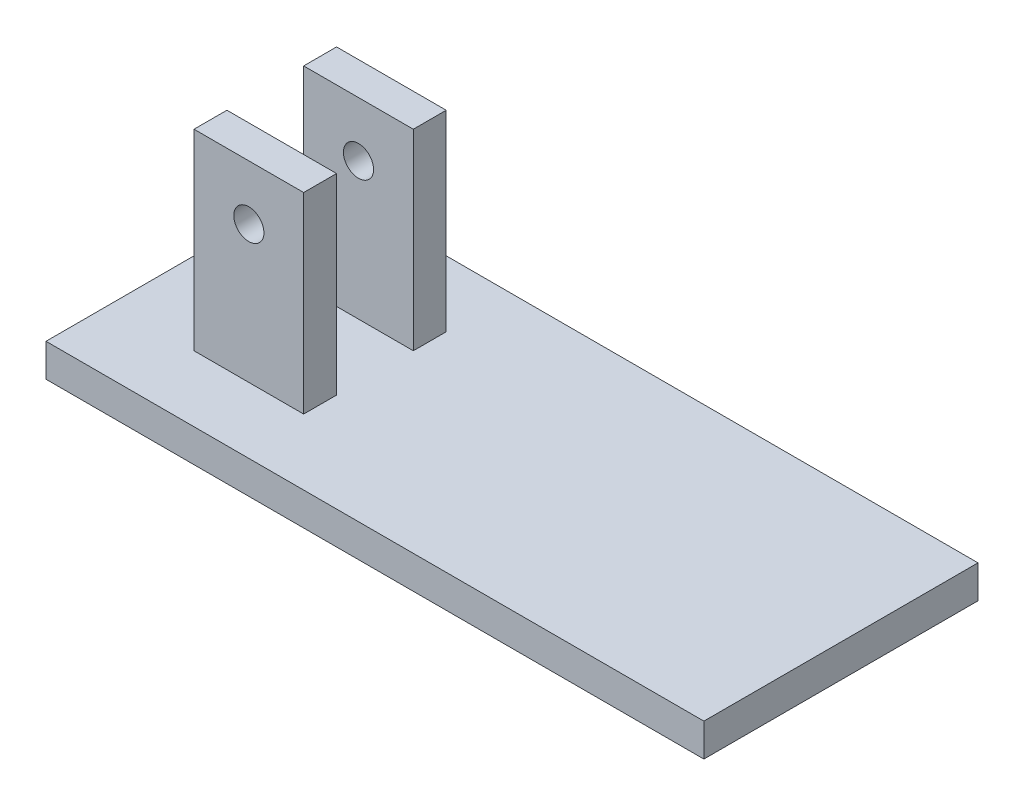
from build123d import *

# Parameters (mm, degrees)
SKETCH1_W               = 120
SKETCH1_H               = 50
BOSS_EXTRUDE1_DEPTH     = 6
SKETCH2_W               = 20
SKETCH2_H               = 6
BOSS_EXTRUDE2_DEPTH     = 35
SKETCH3_W               = 20
SKETCH3_H               = 6
BOSS_EXTRUDE3_DEPTH     = 35
CUT_EXTRUDE1_DEPTH      = 83.006097334
CUT_EXTRUDE1_DEPTH_BACK = 83.006097334
SKETCH4_R               = 2.75


with BuildPart() as part:
    # Sketch1 → Boss-Extrude1 (new body)
    with BuildSketch(Plane(origin=(0, 0, 0), x_dir=(1, 0, 0), z_dir=(0, 1, 0))):
        Rectangle(SKETCH1_W, SKETCH1_H)
    extrude(amount=BOSS_EXTRUDE1_DEPTH)

    # Sketch2 → Boss-Extrude2 (add)
    with BuildSketch(Plane(origin=(0, 6, 0), x_dir=(1, 0, 0), z_dir=(0, 1, 0))):
        with Locations((-35, -10)):
            Rectangle(SKETCH2_W, SKETCH2_H)
    extrude(amount=BOSS_EXTRUDE2_DEPTH)

    # Sketch3 → Boss-Extrude3 (add)
    with BuildSketch(Plane(origin=(0, 6, 0), x_dir=(1, 0, 0), z_dir=(0, 1, 0))):
        with Locations((-35, 10)):
            Rectangle(SKETCH3_W, SKETCH3_H)
    extrude(amount=BOSS_EXTRUDE3_DEPTH)

    # Sketch4 → Cut-Extrude1 (cut, two sides: drawn at the far end of the back side and taken through both)
    with BuildSketch(Plane.XY.offset(13).offset(-CUT_EXTRUDE1_DEPTH_BACK)):
        with Locations((-35, 31)):
            Circle(SKETCH4_R)
    extrude(amount=CUT_EXTRUDE1_DEPTH + CUT_EXTRUDE1_DEPTH_BACK, mode=Mode.SUBTRACT)


solid = part.part
